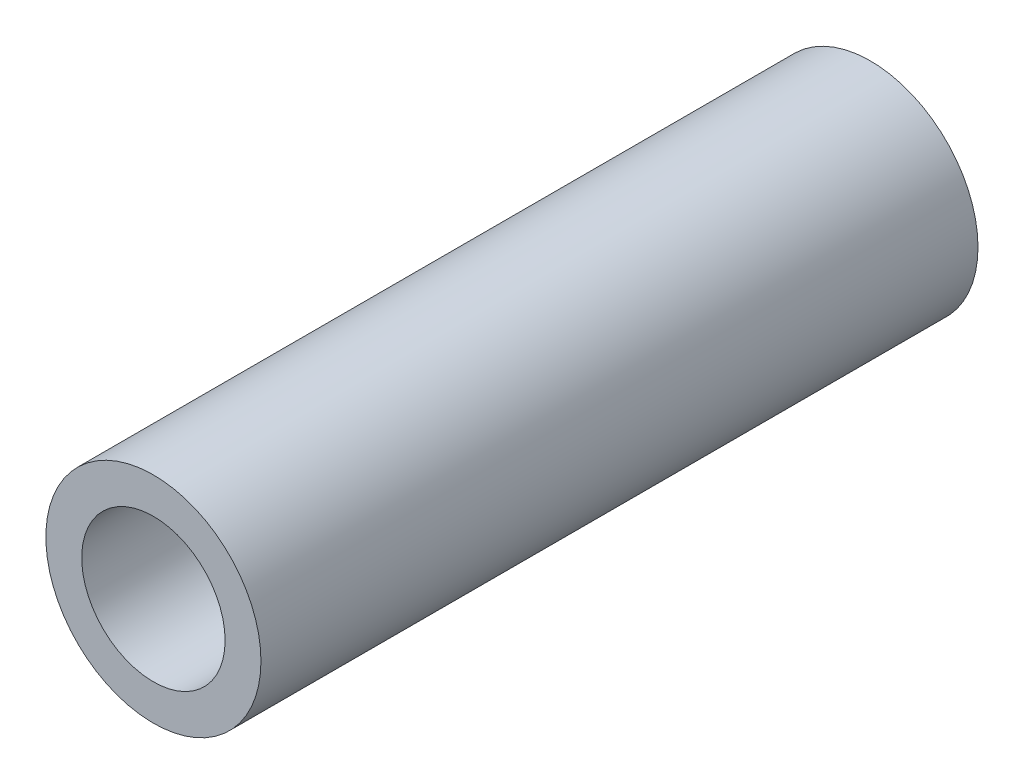
from build123d import *

# Parameters (mm, degrees)
SKETCH3_R          = 7.5
SKETCH2_R          = 7.5
SKETCH1_R          = 5
CUT_EXTRUDE1_DEPTH = 61


with BuildPart() as part:
    # Sketch3 → Loft1 section 0
    with BuildSketch(Plane.XY.offset(50)):
        Circle(SKETCH3_R)
    # Sketch2 → Loft1 section 1
    with BuildSketch(Plane.XY):
        Circle(SKETCH2_R)
    loft()

    # Sketch1 → Cut-Extrude1 (cut)
    with BuildSketch(Plane.XY):
        Circle(SKETCH1_R)
    extrude(amount=CUT_EXTRUDE1_DEPTH, mode=Mode.SUBTRACT)


solid = part.part
